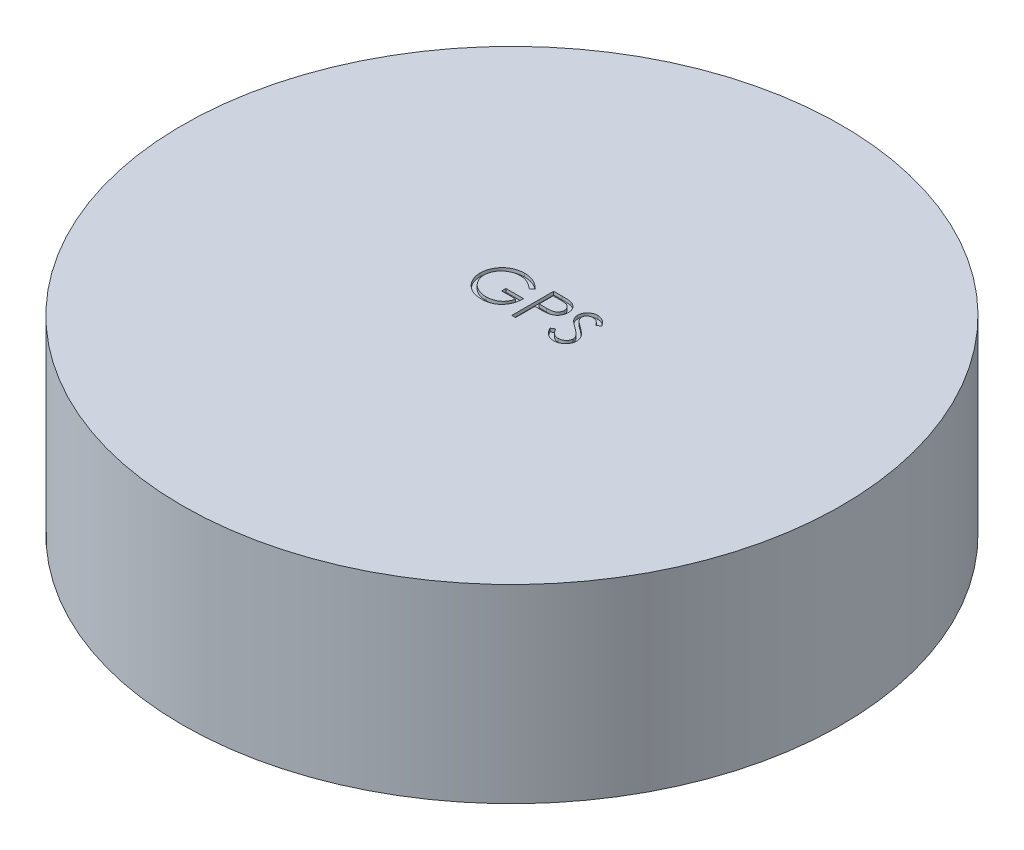
from build123d import *

# Parameters (mm, degrees)
SKETCH1_R           = 25
BOSS_EXTRUDE1_DEPTH = 14.4
CUT_EXTRUDE1_DEPTH  = 0.254


with BuildPart() as part:
    # Sketch1 → Boss-Extrude1 (new body)
    with BuildSketch(Plane(origin=(0, 0, 0), x_dir=(1, 0, 0), z_dir=(0, 1, 0))):
        with Locations(Location((0, 0, 0), (0, 0, 270))):
            Circle(SKETCH1_R)
    extrude(amount=BOSS_EXTRUDE1_DEPTH)

    # Sketch2 → Cut-Extrude1 (cut)
    # profile 1 of 3: a face of its own
    with BuildSketch(Plane(origin=(0, 14.4, 0), x_dir=(1, 0, 0), z_dir=(0, 1, 0))):
        with BuildLine():
            Line((-0.861858974, 2.633112981), (-1.106089744, 2.401602564))
            add(Edge.make_bspline(
                [(-1.106089744, 2.401602564), (-1.150284735, 2.443177704), (-1.237620863, 2.525336601), (-1.380006226, 2.631935861), (-1.528563237, 2.723254395), (-1.682516716, 2.797555052), (-1.838054118, 2.856839342), (-1.993110937, 2.899047012), (-2.14609668, 2.925964242), (-2.247848371, 2.92918312), (-2.297986779, 2.930769231)],
                knots=[0, 0, 0, 0, 1.08915593, 2.152340314, 3.188132944, 4.216796309, 5.218260357, 6.173443236, 7.099959455, 8, 8, 8, 8], degree=3))
            add(Edge.make_bspline(
                [(-2.297986779, 2.930769231), (-2.328752257, 2.930394031), (-2.390203421, 2.929644605), (-2.481481898, 2.920079495), (-2.571803062, 2.906322797), (-2.660996409, 2.88641838), (-2.749235362, 2.86119159), (-2.836213028, 2.829636205), (-2.922091657, 2.792846805), (-3.006062316, 2.750335847), (-3.087469773, 2.703636272), (-3.164356331, 2.651885096), (-3.237212057, 2.596740979), (-3.304667586, 2.536823305), (-3.367110934, 2.47267482), (-3.426028386, 2.405488821), (-3.47934779, 2.33342973), (-3.527509061, 2.257823341), (-3.570472815, 2.179997569), (-3.608399236, 2.1007015), (-3.640237309, 2.020198146), (-3.665428172, 1.93838649), (-3.686211408, 1.855899455), (-3.70083238, 1.772165887), (-3.709075335, 1.687096129), (-3.710501164, 1.630130045), (-3.711217949, 1.601492388)],
                knots=[0, 0, 0, 0, 1.02818874, 2.053710826, 3.065248034, 4.081641283, 5.106893873, 6.131558223, 7.173050175, 8.228653731, 9.27666206, 10.308777013, 11.325269123, 12.329503258, 13.32196095, 14.316845687, 15.314881793, 16.315733098, 17.311955233, 18.285320748, 19.252783886, 20.203351036, 21.145449891, 22.095197417, 23.042428769, 24, 24, 24, 24], degree=3))
            add(Edge.make_bspline(
                [(-3.711217949, 1.601492388), (-3.710532404, 1.572218146), (-3.709163187, 1.513749602), (-3.700399898, 1.426487836), (-3.684136422, 1.340522078), (-3.662394286, 1.255569843), (-3.635197404, 1.17148564), (-3.601295057, 1.088634006), (-3.561139833, 1.007018008), (-3.514660961, 0.927373027), (-3.463692048, 0.849791427), (-3.406593681, 0.776712433), (-3.345941581, 0.707162899), (-3.279526115, 0.642687027), (-3.209476958, 0.581560207), (-3.133701251, 0.525466555), (-3.053689019, 0.473325596), (-2.969318191, 0.425794467), (-2.881504238, 0.383332438), (-2.791464184, 0.345573618), (-2.69891038, 0.314477362), (-2.604329225, 0.289133511), (-2.507833472, 0.26835967), (-2.408933308, 0.254995206), (-2.308355922, 0.245297095), (-2.240557306, 0.244588008), (-2.20640024, 0.244230769)],
                knots=[0, 0, 0, 0, 0.93586088, 1.869166235, 2.799637598, 3.729985548, 4.670839027, 5.622275134, 6.589130586, 7.576015415, 8.568469353, 9.55398029, 10.53834874, 11.515998671, 12.510579167, 13.508179873, 14.527009472, 15.561807829, 16.601455013, 17.643573243, 18.680854198, 19.719860599, 20.772568776, 21.833555941, 22.908541556, 24, 24, 24, 24], degree=3))
            add(Edge.make_bspline(
                [(-2.20640024, 0.244230769), (-2.165235597, 0.245091263), (-2.084402131, 0.246780984), (-1.965578715, 0.259934818), (-1.851457358, 0.280478695), (-1.742358731, 0.310564901), (-1.63815612, 0.348940378), (-1.538467523, 0.395200478), (-1.444077804, 0.451119539), (-1.354703211, 0.514232975), (-1.272373478, 0.584550002), (-1.198120094, 0.660427472), (-1.1331274, 0.741497075), (-1.076426709, 0.827281326), (-1.029519572, 0.918490281), (-0.991017894, 1.014676963), (-0.961505551, 1.115884634), (-0.949390681, 1.185817757), (-0.943269231, 1.221153846)],
                knots=[0, 0, 0, 0, 1.13008108, 2.219097802, 3.278683437, 4.311054135, 5.322181354, 6.324827112, 7.324222904, 8.330512327, 9.32562643, 10.293043162, 11.24128371, 12.174520618, 13.111833804, 14.052305215, 15.015860969, 16, 16, 16, 16], degree=3))
            Line((-0.943269231, 1.221153846), (-2.001602564, 1.221153846))
            Line((-2.001602564, 1.221153846), (-2.001602564, 1.546794872))
            Line((-2.001602564, 1.546794872), (-0.658333333, 1.546794872))
            add(Edge.make_bspline(
                [(-0.658333333, 1.546794872), (-0.659880782, 1.486100221), (-0.662909417, 1.367309826), (-0.684153719, 1.194072509), (-0.718458698, 1.030449616), (-0.765321981, 0.876268829), (-0.825987414, 0.731748642), (-0.899803922, 0.59674232), (-0.987952917, 0.472122045), (-1.087294532, 0.356870449), (-1.198782351, 0.254064664), (-1.319403885, 0.163707849), (-1.44935842, 0.087596191), (-1.588523032, 0.025674018), (-1.736442139, -0.022653106), (-1.893458026, -0.056917322), (-2.059357764, -0.077445931), (-2.173056035, -0.080068825), (-2.231204928, -0.081410256)],
                knots=[0, 0, 0, 0, 1.140356446, 2.231883559, 3.274166699, 4.278491846, 5.25512956, 6.21435461, 7.1637429, 8.11826594, 9.068280886, 10.0076534, 10.945064095, 11.891975133, 12.864533718, 13.863980011, 14.907571808, 16, 16, 16, 16], degree=3))
            add(Edge.make_bspline(
                [(-2.231204928, -0.081410256), (-2.267046265, -0.080893982), (-2.337736933, -0.079875723), (-2.442140846, -0.072639129), (-2.543666117, -0.061498892), (-2.642297953, -0.044675816), (-2.738399164, -0.02407038), (-2.831489787, 0.00231543), (-2.921924439, 0.03285775), (-3.009842897, 0.067597396), (-3.094447165, 0.107848828), (-3.176114076, 0.152579715), (-3.255295062, 0.201559407), (-3.331450762, 0.25563496), (-3.404977975, 0.314401906), (-3.475402599, 0.377978032), (-3.543118889, 0.446168976), (-3.585537309, 0.494591364), (-3.606911058, 0.518990385)],
                knots=[0, 0, 0, 0, 1.107784379, 2.184907829, 3.233506516, 4.263428166, 5.276301166, 6.270063455, 7.25232949, 8.225834625, 9.190232166, 10.146266622, 11.1027726, 12.066435141, 13.031522626, 14.010570082, 14.99756817, 16, 16, 16, 16], degree=3))
            add(Edge.make_bspline(
                [(-3.606911058, 0.518990385), (-3.637922582, 0.557698763), (-3.69943087, 0.634473), (-3.778604627, 0.757481521), (-3.846097328, 0.884846065), (-3.900859566, 1.016921192), (-3.943620545, 1.153583364), (-3.974287645, 1.29465795), (-3.992255686, 1.440326615), (-3.994844252, 1.538901533), (-3.996153846, 1.588772035)],
                knots=[0, 0, 0, 0, 1.023165419, 2.029347347, 3.013907458, 3.994755782, 4.975994455, 5.96558838, 6.970761222, 8, 8, 8, 8], degree=3))
            add(Edge.make_bspline(
                [(-3.996153846, 1.588772035), (-3.99567103, 1.626115707), (-3.994711534, 1.700328436), (-3.983076959, 1.810507565), (-3.966384244, 1.918730336), (-3.941848702, 2.024908283), (-3.910918519, 2.12911232), (-3.872316428, 2.23139083), (-3.827372129, 2.331804171), (-3.775133858, 2.42966118), (-3.717000098, 2.523663326), (-3.653908113, 2.61343219), (-3.58496199, 2.697332985), (-3.511287657, 2.776428266), (-3.432006102, 2.849724363), (-3.347860053, 2.917899877), (-3.258784663, 2.98104626), (-3.1644997, 3.038168896), (-3.066412444, 3.08948018), (-2.964758014, 3.134464679), (-2.859567442, 3.171642401), (-2.751628801, 3.203187187), (-2.640125069, 3.226514493), (-2.525865403, 3.243431569), (-2.40825423, 3.255007256), (-2.328755832, 3.255938217), (-2.288446514, 3.256410256)],
                knots=[0, 0, 0, 0, 1.008945113, 2.00506715, 2.99143336, 3.967273523, 4.948097931, 5.927297278, 6.919902385, 7.919676788, 8.923139349, 9.905703106, 10.883022732, 11.856032218, 12.825136022, 13.798837087, 14.781400844, 15.773989409, 16.776158564, 17.77167057, 18.775803737, 19.789618931, 20.80898985, 21.851988756, 22.910860228, 24, 24, 24, 24], degree=3))
            add(Edge.make_bspline(
                [(-2.288446514, 3.256410256), (-2.255573251, 3.255884575), (-2.190389431, 3.254842209), (-2.093392517, 3.247617136), (-1.997894854, 3.236165472), (-1.903754843, 3.220538316), (-1.811293068, 3.199253397), (-1.720246128, 3.173782381), (-1.630482041, 3.144126228), (-1.54228213, 3.108757774), (-1.455053344, 3.068613415), (-1.368310675, 3.023425524), (-1.282350502, 2.972421413), (-1.197023754, 2.915449634), (-1.111792369, 2.853488677), (-1.028004443, 2.784766415), (-0.943637487, 2.711992915), (-0.889388698, 2.659666934), (-0.861858974, 2.633112981)],
                knots=[0, 0, 0, 0, 0.985871117, 1.954866573, 2.915460327, 3.869826059, 4.81536089, 5.759505086, 6.70452669, 7.649098992, 8.607881297, 9.583363685, 10.581137262, 11.603961102, 12.659522466, 13.73993555, 14.853081303, 16, 16, 16, 16], degree=3))
        make_face()
    # profile 2 of 3: a face of its own
    with BuildSketch(Plane(origin=(0, 14.4, 0), x_dir=(1, 0, 0), z_dir=(0, 1, 0))):
        with BuildLine():
            Line((-0.007051282, 3.175), (0.615609976, 3.175))
            add(Edge.make_bspline(
                [(0.615609976, 3.175), (0.658437012, 3.174952923), (0.740495516, 3.17486272), (0.858165602, 3.172127915), (0.965035859, 3.16847513), (1.060875847, 3.163411556), (1.14598045, 3.157427506), (1.219964572, 3.149034585), (1.283409741, 3.140271317), (1.321424877, 3.131361898), (1.338762019, 3.127298678)],
                knots=[0, 0, 0, 0, 1.415646017, 2.712440637, 3.8905458, 4.950247383, 5.884950622, 6.709939814, 7.411656543, 8, 8, 8, 8], degree=3))
            add(Edge.make_bspline(
                [(1.338762019, 3.127298678), (1.360709011, 3.121291623), (1.40408584, 3.109419063), (1.466588929, 3.085639471), (1.526055632, 3.057443507), (1.582689974, 3.025308933), (1.635796007, 2.987857028), (1.686166058, 2.946605961), (1.733355612, 2.900603324), (1.777099303, 2.850365081), (1.817271941, 2.796734605), (1.85186101, 2.738911296), (1.880823566, 2.677868471), (1.905664105, 2.613648589), (1.923542489, 2.545712367), (1.937010748, 2.474531849), (1.945559324, 2.400114666), (1.946378077, 2.349260357), (1.946794872, 2.323372396)],
                knots=[0, 0, 0, 0, 0.999701418, 1.975846123, 2.934577507, 3.890451536, 4.834027766, 5.787354733, 6.749476667, 7.726910423, 8.712836071, 9.690891519, 10.682875813, 11.679750201, 12.712814741, 13.765529915, 14.8625177, 16, 16, 16, 16], degree=3))
            add(Edge.make_bspline(
                [(1.946794872, 2.323372396), (1.946412579, 2.297266841), (1.945664598, 2.24618956), (1.936687254, 2.171465674), (1.924594866, 2.100056849), (1.906001111, 2.032121418), (1.881648251, 1.968062827), (1.85308046, 1.906902138), (1.818623971, 1.849679864), (1.779031876, 1.796188264), (1.734988644, 1.74637713), (1.686680621, 1.700607423), (1.634302835, 1.659147059), (1.578021743, 1.62190309), (1.517288666, 1.589739179), (1.453024712, 1.560930767), (1.384671302, 1.536736305), (1.337370593, 1.524009035), (1.313321314, 1.517538061)],
                knots=[0, 0, 0, 0, 1.121902311, 2.195077645, 3.232258892, 4.234102512, 5.217864754, 6.176164875, 7.132989551, 8.084763148, 9.034132444, 9.988522005, 10.94243251, 11.903244335, 12.886203696, 13.894208494, 14.929344452, 16, 16, 16, 16], degree=3))
            add(Edge.make_bspline(
                [(1.313321314, 1.517538061), (1.29343009, 1.513308071), (1.249837315, 1.504037802), (1.17804356, 1.493688702), (1.094454531, 1.484855307), (0.99918432, 1.478232132), (0.892318442, 1.472562155), (0.773799087, 1.468055384), (0.643393603, 1.465579017), (0.55243326, 1.465451298), (0.504942909, 1.465384615)],
                knots=[0, 0, 0, 0, 0.601384939, 1.31797006, 2.144135048, 3.087295005, 4.142315834, 5.309527816, 6.595305764, 8, 8, 8, 8], degree=3))
            Line((0.504942909, 1.465384615), (0.277884615, 1.465384615))
            Line((0.277884615, 1.465384615), (0.277884615, 0))
            Line((0.277884615, 0), (-0.007051282, 0))
            Line((-0.007051282, 0), (-0.007051282, 3.175))
        make_face()
        with BuildLine():
            Line((0.277884615, 2.849358974), (0.277884615, 1.791025641))
            Line((0.277884615, 1.791025641), (0.833764022, 1.784029447))
            add(Edge.make_bspline(
                [(0.833764022, 1.784029447), (0.860905669, 1.784015419), (0.913302059, 1.783988339), (0.988990633, 1.787603506), (1.059211915, 1.791776847), (1.123750209, 1.797887291), (1.182634606, 1.806524432), (1.235963293, 1.815243652), (1.283322757, 1.827857802), (1.338748462, 1.8448423), (1.400509784, 1.873809745), (1.467699632, 1.915855716), (1.524641521, 1.969450359), (1.573915975, 2.029709891), (1.613019165, 2.096746959), (1.641644958, 2.16847378), (1.658464436, 2.244154758), (1.660719769, 2.295941855), (1.661858974, 2.322100361)],
                knots=[0, 0, 0, 0, 1.160613943, 2.240541288, 3.23993089, 4.169200891, 5.011653406, 5.7853311, 6.478053781, 7.106038997, 8.262395093, 9.384106736, 10.481365981, 11.59014053, 12.70357646, 13.786202915, 14.881775077, 16, 16, 16, 16], degree=3))
            add(Edge.make_bspline(
                [(1.661858974, 2.322100361), (1.660713574, 2.347626012), (1.658436659, 2.398367848), (1.641513126, 2.472734295), (1.61307482, 2.543705256), (1.57365348, 2.609902269), (1.525809741, 2.669944969), (1.47020248, 2.722103078), (1.406962593, 2.764032765), (1.348135983, 2.791095813), (1.295883479, 2.80761967), (1.250497343, 2.819181061), (1.199252232, 2.82841179), (1.14213146, 2.835886196), (1.079577761, 2.842284693), (1.011053718, 2.846626258), (0.936818913, 2.849167579), (0.88528361, 2.849293631), (0.85856871, 2.849358974)],
                knots=[0, 0, 0, 0, 1.120700087, 2.227813068, 3.331159281, 4.466773991, 5.599788987, 6.693661531, 7.80175334, 8.91857717, 9.525282508, 10.207424825, 10.974604443, 11.810962634, 12.737642355, 13.736264703, 14.826523623, 16, 16, 16, 16], degree=3))
            Line((0.85856871, 2.849358974), (0.277884615, 2.849358974))
        make_face(mode=Mode.SUBTRACT)
    # profile 3 of 3: a face of its own
    with BuildSketch(Plane(origin=(0, 14.4, 0), x_dir=(1, 0, 0), z_dir=(0, 1, 0))):
        with BuildLine():
            Line((2.272435897, 0.612484976), (2.540835337, 0.773397436))
            add(Edge.make_bspline(
                [(2.540835337, 0.773397436), (2.565798309, 0.731610458), (2.613626401, 0.651548221), (2.693410848, 0.543364142), (2.776081417, 0.451414185), (2.862250313, 0.376233263), (2.951391566, 0.317043201), (3.0440871, 0.275131177), (3.140024543, 0.24899097), (3.205315081, 0.245815892), (3.237910657, 0.244230769)],
                knots=[0, 0, 0, 0, 1.272034388, 2.437168799, 3.508375237, 4.49857839, 5.41946034, 6.295179144, 7.148887113, 8, 8, 8, 8], degree=3))
            add(Edge.make_bspline(
                [(3.237910657, 0.244230769), (3.265748023, 0.245006079), (3.320935667, 0.246543133), (3.402181416, 0.261312147), (3.481086337, 0.284001721), (3.556024173, 0.316496423), (3.625960909, 0.355810621), (3.68728984, 0.403296082), (3.740308814, 0.456460283), (3.78367851, 0.515771691), (3.816952542, 0.57955939), (3.842526776, 0.645033288), (3.856719093, 0.713221918), (3.858857005, 0.759132838), (3.859935897, 0.782301683)],
                knots=[0, 0, 0, 0, 1.095163259, 2.171163733, 3.241058638, 4.321873601, 5.38011039, 6.391990106, 7.366004449, 8.327778327, 9.272591725, 10.192022065, 11.087607919, 12, 12, 12, 12], degree=3))
            add(Edge.make_bspline(
                [(3.859935897, 0.782301683), (3.858598487, 0.808736596), (3.855879727, 0.862474913), (3.832900456, 0.941758884), (3.796751496, 1.020220001), (3.763402527, 1.068753292), (3.746088742, 1.093950321)],
                knots=[0, 0, 0, 0, 0.938893495, 1.908633276, 2.914225137, 4, 4, 4, 4], degree=3))
            add(Edge.make_bspline(
                [(3.746088742, 1.093950321), (3.731873256, 1.112135653), (3.702029622, 1.150313485), (3.650723879, 1.207141663), (3.590520332, 1.2657598), (3.52347925, 1.32840623), (3.447158519, 1.392167303), (3.36394856, 1.460083527), (3.271724917, 1.5295721), (3.207046087, 1.576174356), (3.173672877, 1.600220353)],
                knots=[0, 0, 0, 0, 0.722233717, 1.516239348, 2.393582979, 3.351407094, 4.387010283, 5.505090956, 6.712668013, 8, 8, 8, 8], degree=3))
            add(Edge.make_bspline(
                [(3.173672877, 1.600220353), (3.140268251, 1.624013428), (3.076401152, 1.669503978), (2.987085152, 1.737017435), (2.907216247, 1.798742946), (2.837149424, 1.855261585), (2.776915504, 1.90658102), (2.726039839, 1.952208436), (2.685818433, 1.993377809), (2.6634523, 2.020085312), (2.653410457, 2.032076322)],
                knots=[0, 0, 0, 0, 1.452282411, 2.77665338, 3.964542531, 5.026858415, 5.96415736, 6.766646006, 7.446254459, 8, 8, 8, 8], degree=3))
            add(Edge.make_bspline(
                [(2.653410457, 2.032076322), (2.639374648, 2.050764406), (2.611771346, 2.08751703), (2.575335041, 2.144961722), (2.544365943, 2.203765684), (2.520088685, 2.264086933), (2.499645115, 2.325078618), (2.485894706, 2.387536534), (2.477284653, 2.451180424), (2.476402923, 2.494009814), (2.475961538, 2.51544972)],
                knots=[0, 0, 0, 0, 1.068054152, 2.10047183, 3.106115577, 4.101338837, 5.06977816, 6.043150881, 7.020423561, 8, 8, 8, 8], degree=3))
            add(Edge.make_bspline(
                [(2.475961538, 2.51544972), (2.477145549, 2.549041015), (2.479488264, 2.615505616), (2.499300733, 2.712597869), (2.530572573, 2.805295548), (2.574382935, 2.892680922), (2.630859248, 2.972478633), (2.696215239, 3.045606582), (2.774058516, 3.107082367), (2.859468396, 3.160796163), (2.952955247, 3.202838538), (3.050918424, 3.234553141), (3.153513625, 3.252522968), (3.223003612, 3.255101762), (3.258263221, 3.256410256)],
                knots=[0, 0, 0, 0, 1.005424448, 1.989358655, 2.955360095, 3.929531133, 4.905563448, 5.876582895, 6.856512386, 7.866279853, 8.892233794, 9.918561126, 10.94386622, 12, 12, 12, 12], degree=3))
            add(Edge.make_bspline(
                [(3.258263221, 3.256410256), (3.295677512, 3.255119799), (3.370082596, 3.252553491), (3.47952867, 3.230240016), (3.584903034, 3.193318692), (3.669669424, 3.151418981), (3.736011286, 3.109571197), (3.786605122, 3.071453213), (3.837874524, 3.027570079), (3.890233045, 2.977804906), (3.942793501, 2.921701067), (3.996336204, 2.8596428), (4.050986362, 2.792009352), (4.086143464, 2.743727127), (4.104166667, 2.718975361)],
                knots=[0, 0, 0, 0, 1.286793592, 2.559021753, 3.825965368, 5.121522368, 5.803751409, 6.523245864, 7.299691795, 8.125521123, 9.008227632, 9.944561021, 10.946284179, 12, 12, 12, 12], degree=3))
            Line((4.104166667, 2.718975361), (3.846579527, 2.523717949))
            add(Edge.make_bspline(
                [(3.846579527, 2.523717949), (3.831025717, 2.543755546), (3.801072715, 2.582343275), (3.755598109, 2.636382968), (3.712736836, 2.685746489), (3.670508973, 2.728622712), (3.63114475, 2.767359647), (3.592938576, 2.80052457), (3.556440272, 2.828442431), (3.510432789, 2.858236232), (3.452631716, 2.887769632), (3.380074315, 2.912760581), (3.304249623, 2.927778387), (3.252606314, 2.929764021), (3.22646234, 2.930769231)],
                knots=[0, 0, 0, 0, 1.181633172, 2.275549214, 3.290209073, 4.226197932, 5.078386478, 5.862611352, 6.581680152, 7.217281963, 8.414376989, 9.595101626, 10.782541182, 12, 12, 12, 12], degree=3))
            add(Edge.make_bspline(
                [(3.22646234, 2.930769231), (3.193663209, 2.929670046), (3.130413174, 2.927550371), (3.040614889, 2.904400099), (2.959793971, 2.867949411), (2.890349858, 2.816863681), (2.832531315, 2.756338209), (2.790707077, 2.686688819), (2.765533714, 2.609779068), (2.762461874, 2.556129137), (2.760897436, 2.52880609)],
                knots=[0, 0, 0, 0, 1.14458467, 2.207223713, 3.21896685, 4.227309161, 5.202851033, 6.127160689, 7.046193047, 8, 8, 8, 8], degree=3))
            add(Edge.make_bspline(
                [(2.760897436, 2.52880609), (2.761254058, 2.51179582), (2.761967885, 2.477747465), (2.771923594, 2.427445104), (2.7847137, 2.377269817), (2.804981659, 2.327447189), (2.832962756, 2.277105877), (2.869706737, 2.225379015), (2.915983098, 2.17181068), (2.951431531, 2.136969705), (2.970147236, 2.11857472)],
                knots=[0, 0, 0, 0, 0.858281714, 1.717966888, 2.583508476, 3.4729293, 4.427298488, 5.488583878, 6.674047936, 8, 8, 8, 8], degree=3))
            add(Edge.make_bspline(
                [(2.970147236, 2.11857472), (2.977097195, 2.11237256), (2.993608707, 2.09763765), (3.023794726, 2.073514653), (3.063657121, 2.043757852), (3.112154975, 2.006939358), (3.17018251, 1.964229746), (3.237746108, 1.916175112), (3.314092641, 1.861215445), (3.36826895, 1.822791105), (3.396915064, 1.802473958)],
                knots=[0, 0, 0, 0, 0.420754252, 0.999615792, 1.744751191, 2.668019286, 3.750313428, 4.999500688, 6.413464383, 8, 8, 8, 8], degree=3))
            add(Edge.make_bspline(
                [(3.396915064, 1.802473958), (3.431373714, 1.777399296), (3.498098114, 1.728845689), (3.59303749, 1.655897179), (3.67911973, 1.584552418), (3.756647065, 1.515267017), (3.826385403, 1.448566533), (3.88756105, 1.383648505), (3.940797345, 1.320978021), (3.998109922, 1.240630042), (4.056673087, 1.141950058), (4.106966454, 1.021047656), (4.13867867, 0.899675279), (4.142825687, 0.818098792), (4.144871795, 0.777849559)],
                knots=[0, 0, 0, 0, 1.163667725, 2.253281268, 3.268753668, 4.215851969, 5.092017293, 5.902905408, 6.650798638, 7.335211899, 8.59617414, 9.77448103, 10.901945474, 12, 12, 12, 12], degree=3))
            add(Edge.make_bspline(
                [(4.144871795, 0.777849559), (4.144275677, 0.7493849), (4.143095017, 0.693008344), (4.129523331, 0.610226953), (4.109639063, 0.529826093), (4.079669572, 0.452799584), (4.043090707, 0.377738263), (3.996675611, 0.306611097), (3.942875068, 0.237843864), (3.881158724, 0.173270268), (3.813625656, 0.113991933), (3.742248304, 0.06126057), (3.666909842, 0.017292877), (3.588018969, -0.018585387), (3.505557564, -0.046646507), (3.41955336, -0.066978181), (3.329864589, -0.079456576), (3.268904152, -0.080751759), (3.237910657, -0.081410256)],
                knots=[0, 0, 0, 0, 0.983748083, 1.948392443, 2.894712957, 3.844097841, 4.80183111, 5.778335162, 6.776009319, 7.81870978, 8.863265674, 9.881300176, 10.883814829, 11.87499822, 12.874611388, 13.892143829, 14.928324115, 16, 16, 16, 16], degree=3))
            add(Edge.make_bspline(
                [(3.237910657, -0.081410256), (3.213930024, -0.080946542), (3.166270771, -0.080024952), (3.095777169, -0.071877648), (3.026707685, -0.06035049), (2.959929015, -0.042049726), (2.894580791, -0.019845611), (2.830947229, 0.007494162), (2.768997487, 0.040257623), (2.708384394, 0.07771811), (2.649262107, 0.12131335), (2.592185161, 0.172089307), (2.535280828, 0.228645587), (2.48022869, 0.292518026), (2.425915195, 0.362674716), (2.373411209, 0.439772046), (2.321629937, 0.523390074), (2.289140191, 0.582231974), (2.272435897, 0.612484976)],
                knots=[0, 0, 0, 0, 0.915332311, 1.819136955, 2.706846663, 3.586547465, 4.459518054, 5.340707479, 6.227863349, 7.133153174, 8.059268498, 9.028702269, 10.047606654, 11.120612155, 12.245963614, 13.433783089, 14.680604001, 16, 16, 16, 16], degree=3))
        make_face()
    extrude(amount=-CUT_EXTRUDE1_DEPTH, mode=Mode.SUBTRACT)


solid = part.part
